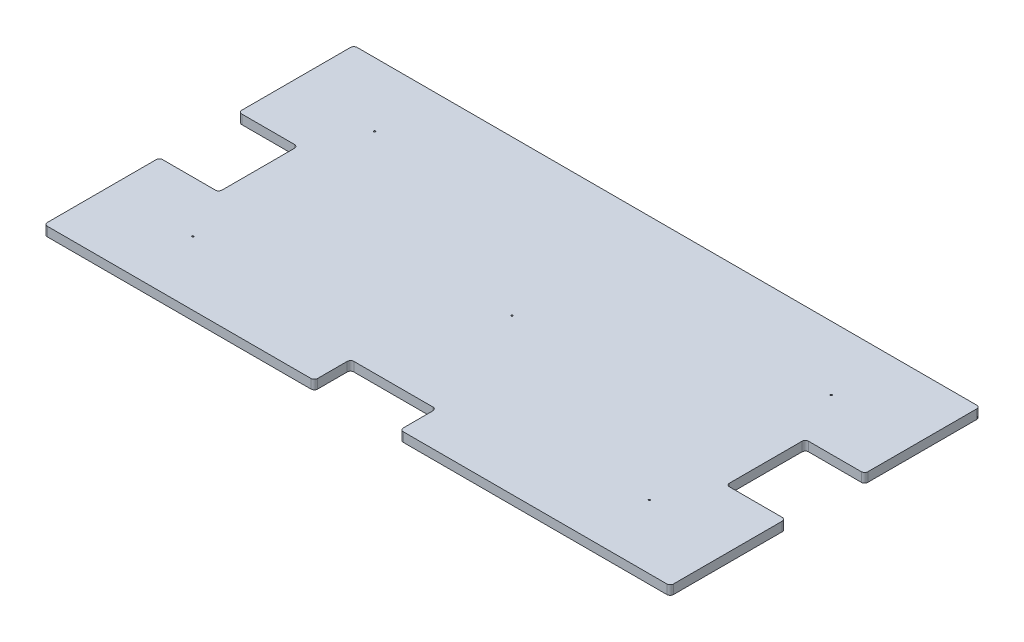
from build123d import *

# Parameters (mm, degrees)
SKETCH1_W                    = 1206.5
SKETCH1_H                    = 596.9
BOSS_EXTRUDE1_DEPTH          = 17.78
FILLET1_R                    = 6.35
SKETCH4_W                    = 165.1
SKETCH4_H                    = 69.85
SKETCH4_W_2                  = 114.3
SKETCH4_H_2                  = 152.4
CUT_EXTRUDE1_DEPTH           = 674.274901805
FILLET2_R                    = 6.35
F_1_8_0_125_DIAMETER_HOLE2_D = 3.175


with BuildPart() as part:
    # Sketch1 → Boss-Extrude1 (new body)
    with BuildSketch(Plane(origin=(0, 0, 0), x_dir=(1, 0, 0), z_dir=(0, 1, 0))):
        Rectangle(SKETCH1_W, SKETCH1_H)
    extrude(amount=BOSS_EXTRUDE1_DEPTH)

    # Fillet1
    fillet1_edges = [part.edges().sort_by_distance(p)[0] for p in [
        (603.25, 8.89, 298.45),
        (-603.25, 8.89, 298.45),
        (-603.25, 8.89, -298.45),
        (603.25, 8.89, -298.45),
    ]]
    fillet(fillet1_edges, radius=FILLET1_R)

    # Sketch4 → Cut-Extrude1 (cut, through all)
    with BuildSketch(Plane(origin=(0, 17.78, 0), x_dir=(1, 0, 0), z_dir=(0, 1, 0))):
        with Locations((0, -263.525)):
            Rectangle(SKETCH4_W, SKETCH4_H)
        with Locations((-546.1, 0)):
            Rectangle(SKETCH4_W_2, SKETCH4_H_2)
        with Locations((546.1, 0)):
            Rectangle(SKETCH4_W_2, SKETCH4_H_2)
    extrude(amount=-CUT_EXTRUDE1_DEPTH, mode=Mode.SUBTRACT)

    # Fillet2
    fillet2_edges = [part.edges().sort_by_distance(p)[0] for p in [
        (82.55, 8.89, 228.6),
        (82.55, 8.89, 298.45),
        (-82.55, 8.89, 298.45),
        (-82.55, 8.89, 228.6),
        (-603.25, 8.89, 76.2),
        (-603.25, 8.89, -76.2),
        (-488.95, 8.89, -76.2),
        (-488.95, 8.89, 76.2),
        (603.25, 8.89, -76.2),
        (603.25, 8.89, 76.2),
        (488.95, 8.89, 76.2),
        (488.95, 8.89, -76.2),
    ]]
    fillet(fillet2_edges, radius=FILLET2_R)

    # 1/8 (0.125) Diameter Hole2 (through all)
    with Locations(Plane(origin=(0, 0, 0), x_dir=(-1, 0, 0), z_dir=(0, -1, 0))):
        with Locations((-439.865615282, 175.258956089), (439.865615282, 175.258956089), (439.865615282, -175.258956089), (0, 0), (-439.865615282, -175.258956089)):
            Hole(F_1_8_0_125_DIAMETER_HOLE2_D / 2)


solid = part.part
